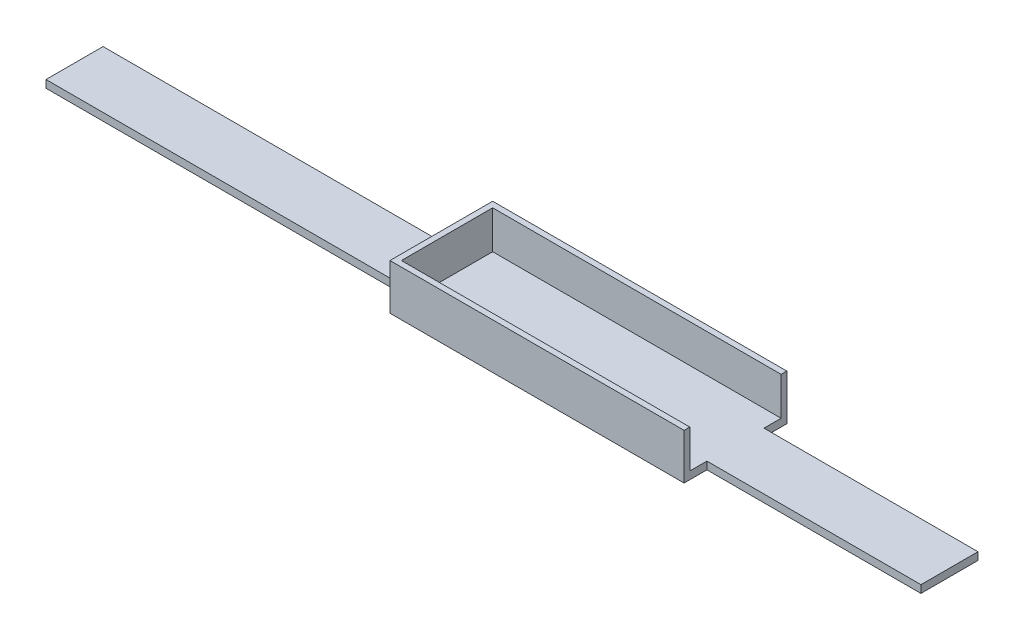
from build123d import *

# Parameters (mm, degrees)
CROQUIS1_W                   = 230
CROQUIS1_H                   = 15
SALIENTE_EXTRUIR1_DEPTH      = 2
CROQUIS2_W                   = 45
CROQUIS2_H                   = 22
SALIENTE_EXTRUIR2_DEPTH      = 5
CROQUIS3_W                   = 45
CROQUIS3_H                   = 22
SALIENTE_EXTRUIR3_DEPTH      = 5
SALIENTE_EXTRUIR4_DEPTH      = 6
SALIENTE_EXTRUIR4_DEPTH_BACK = 21
CROQUIS6_W                   = 77.325066443
CROQUIS6_H                   = 2
SALIENTE_EXTRUIR5_DEPTH      = 10
CORTAR_EXTRUIR1_REACH        = 130.721
CROQUIS9_W                   = 5
CROQUIS9_H                   = 22


with BuildPart() as part:
    # Croquis1 → Saliente-Extruir1 (new body)
    with BuildSketch(Plane(origin=(0, 0, 0), x_dir=(1, 0, 0), z_dir=(0, 1, 0))):
        with Locations((0, 4.747757848)):
            Rectangle(CROQUIS1_W, CROQUIS1_H)
    extrude(amount=SALIENTE_EXTRUIR1_DEPTH)

    # Croquis2 → Saliente-Extruir2 (add)
    with BuildSketch(Plane(origin=(115, 0, 0), x_dir=(0, 0, -1), z_dir=(1, 0, 0))):
        with Locations((4.747757848, 1)):
            Rectangle(CROQUIS2_W, CROQUIS2_H)
    extrude(amount=SALIENTE_EXTRUIR2_DEPTH)

    # Croquis3 → Saliente-Extruir3 (add)
    with BuildSketch(Plane.ZY.offset(115)):
        with Locations((-4.747757848, 1)):
            Rectangle(CROQUIS3_W, CROQUIS3_H)
    extrude(amount=SALIENTE_EXTRUIR3_DEPTH)

    # Croquis6 → Saliente-Extruir4 (add, two sides: drawn at the far end of the back side and taken through both)
    with BuildSketch(Plane(origin=(0, 0, -12.247757848), x_dir=(-1, 0, 0), z_dir=(0, 0, -1)).offset(-SALIENTE_EXTRUIR4_DEPTH_BACK)):
        with Locations((-20.080179861, 1)):
            Rectangle(CROQUIS6_W, CROQUIS6_H)
    extrude(amount=SALIENTE_EXTRUIR4_DEPTH + SALIENTE_EXTRUIR4_DEPTH_BACK)

    # Croquis7 → Saliente-Extruir5 (add)
    with BuildSketch(Plane(origin=(0, 2, 0), x_dir=(1, 0, 0), z_dir=(0, 1, 0))):
        Polygon((-18.58235336, 18.247757848), (-18.58235336, -8.752242152), (58.742713083, -8.752242152), (58.742713083, -7.252242152), (-17.08235336, -7.252242152), (-17.08235336, 16.747757848), (58.742713083, 16.747757848), (58.742713083, 18.247757848), align=None)
    extrude(amount=SALIENTE_EXTRUIR5_DEPTH)

    # Croquis9 → Cortar-Extruir1 (cut, up to next)
    with BuildSketch(Plane.XY.offset(17.752242152), mode=Mode.PRIVATE) as cortar_extruir1_sk1:
        with Locations((-117.5, 1)):
            Rectangle(CROQUIS9_W, CROQUIS9_H)
    cortar_extruir1_tool1 = extrude(cortar_extruir1_sk1.sketch, amount=-CORTAR_EXTRUIR1_REACH, mode=Mode.PRIVATE) & part.part
    # Croquis9 → Cortar-Extruir1 (cut, up to next)
    with BuildSketch(Plane.XY.offset(17.752242152), mode=Mode.PRIVATE) as cortar_extruir1_sk2:
        with Locations((117.5, 1)):
            Rectangle(CROQUIS9_W, CROQUIS9_H)
    cortar_extruir1_tool2 = extrude(cortar_extruir1_sk2.sketch, amount=-CORTAR_EXTRUIR1_REACH, mode=Mode.PRIVATE) & part.part
    add(cortar_extruir1_tool1.solids().sort_by_distance((-117.5, 1, 17.752242))[0], mode=Mode.SUBTRACT)
    add(cortar_extruir1_tool2.solids().sort_by_distance((117.5, 1, 17.752242))[0], mode=Mode.SUBTRACT)


solid = part.part
